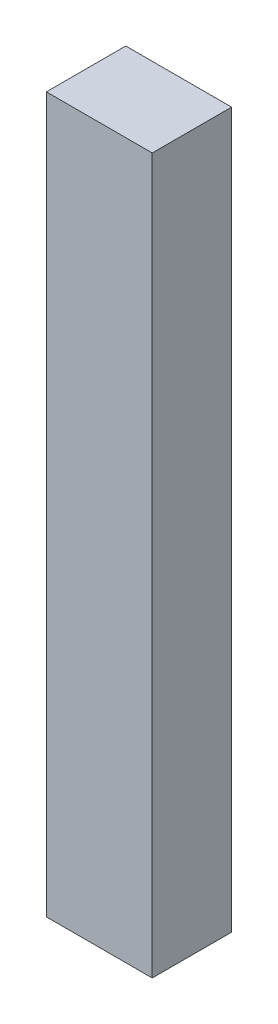
from build123d import *

# Parameters (mm, degrees)
SKETCH1_W           = 2
SKETCH1_H           = 13.5
BOSS_EXTRUDE1_DEPTH = 1.5
SCALE2_SCALE        = 10


with BuildPart() as part:
    # Sketch1 → Boss-Extrude1 (new body)
    with BuildSketch(Plane.XY):
        with Locations((1, 6.75)):
            Rectangle(SKETCH1_W, SKETCH1_H)
    extrude(amount=BOSS_EXTRUDE1_DEPTH)


with BuildPart() as part_1:
    # Scale2: scaled about (0, 0, 0)
    add(part.part.scale(SCALE2_SCALE))


solid = part_1.part
